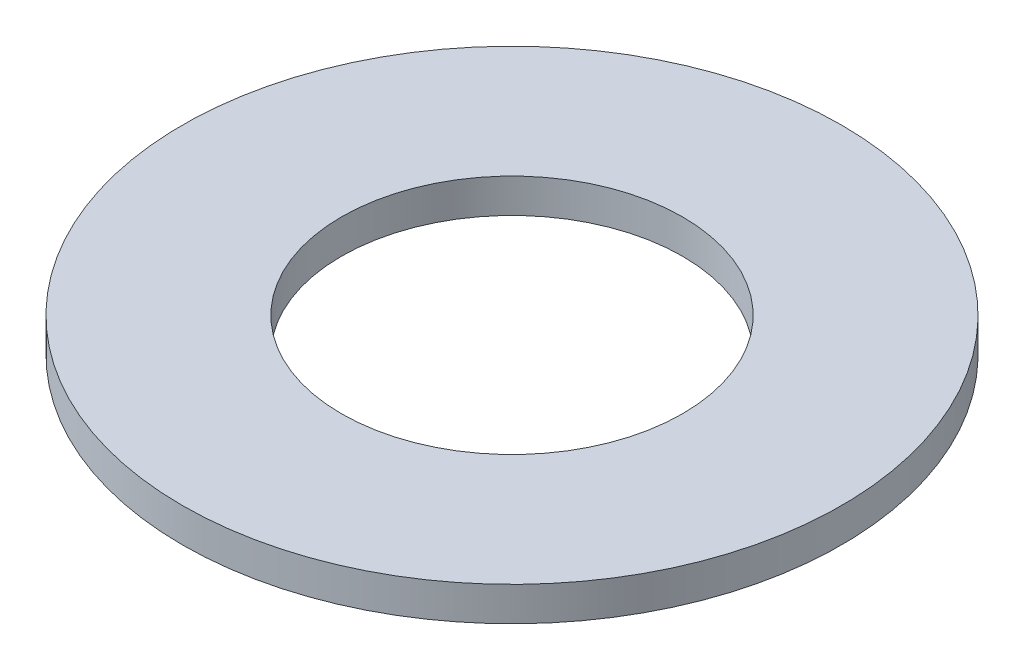
from build123d import *

# Parameters (mm, degrees)
SKETCH1_R           = 22.21
SKETCH1_R_2         = 11.4935
BOSS_EXTRUDE1_DEPTH = 2.3


with BuildPart() as part:
    # Sketch1 → Boss-Extrude1 (new body)
    with BuildSketch(Plane(origin=(0, 0, 0), x_dir=(1, 0, 0), z_dir=(0, 1, 0))):
        with Locations(Location((0, 0, 0), (0, 0, 270))):
            Circle(SKETCH1_R)
        with Locations(Location((0, 0, 0), (0, 0, 270))):
            Circle(SKETCH1_R_2, mode=Mode.SUBTRACT)
    extrude(amount=BOSS_EXTRUDE1_DEPTH)


solid = part.part
